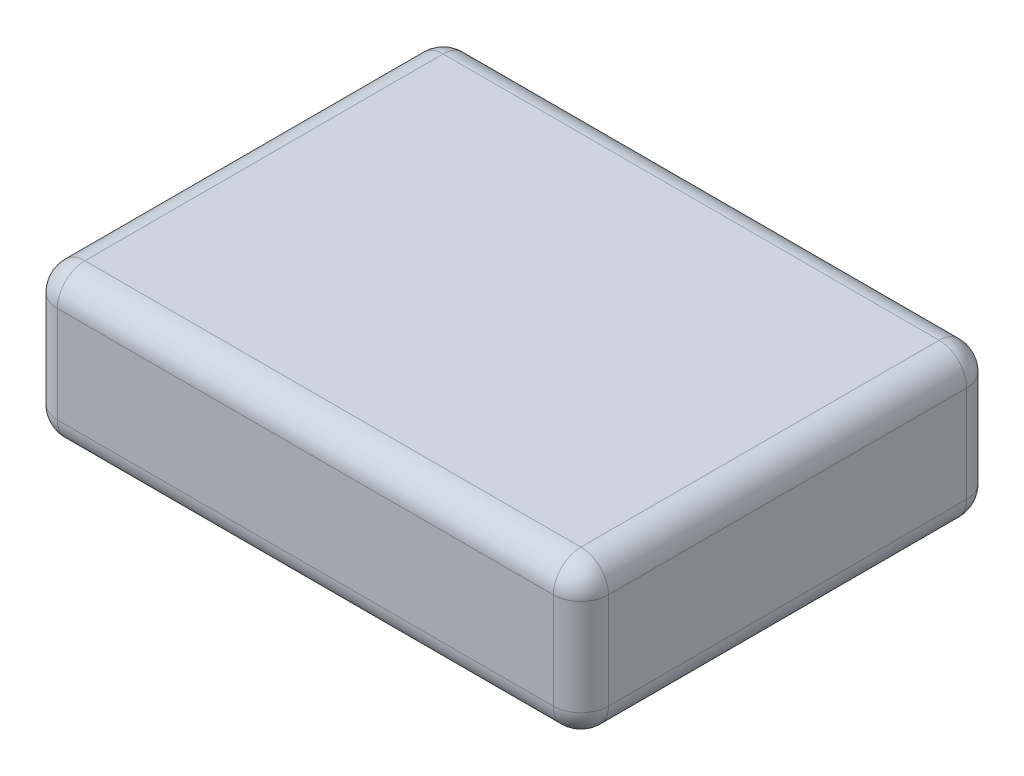
from build123d import *

# Parameters (mm, degrees)
SKETCH_1_W      = 40
SKETCH_1_H      = 30
EXTRUDE_1_DEPTH = 11
FILLET_1_R      = 2


with BuildPart() as part:
    # 草图1 → 凸台-拉伸1 (new body)
    with BuildSketch(Plane(origin=(0, 0, 0), x_dir=(1, 0, 0), z_dir=(0, 1, 0))):
        with Locations((20, 15)):
            Rectangle(SKETCH_1_W, SKETCH_1_H)
    extrude(amount=EXTRUDE_1_DEPTH)

    # 圆角1
    fillet_1_edges = [part.edges().sort_by_distance(p)[0] for p in [
        (40, 11, -15),
        (20, 11, -30),
        (0, 11, -15),
        (20, 0, -30),
        (40, 0, -15),
        (20, 0, 0),
        (0, 0, -15),
        (0, 5.5, -30),
        (40, 5.5, -30),
        (40, 5.5, 0),
        (0, 5.5, 0),
        (20, 11, 0),
    ]]
    fillet(fillet_1_edges, radius=FILLET_1_R)


solid = part.part
